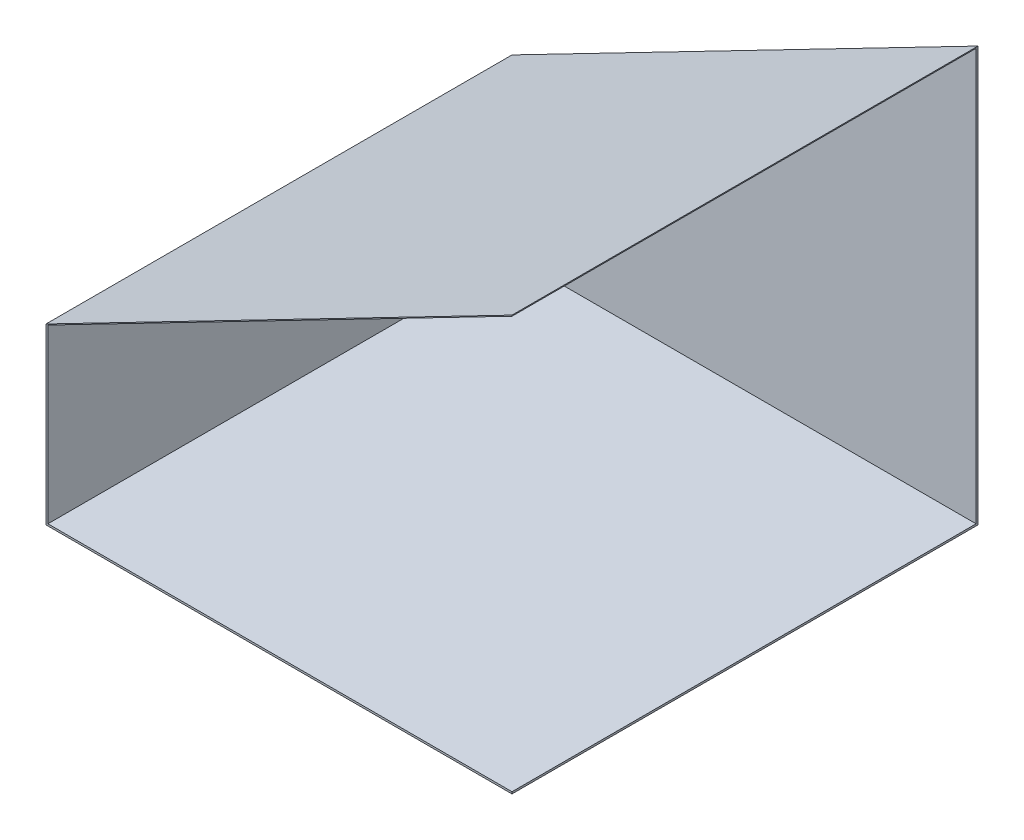
from build123d import *

# Parameters (mm, degrees)
SKETCH2_W           = 12192
SKETCH2_H           = 12192
BOSS_EXTRUDE1_DEPTH = 50.8
SKETCH3_W           = 12192
SKETCH3_H           = 4572
BOSS_EXTRUDE2_DEPTH = 50.8
SKETCH4_W           = 12242.8
SKETCH4_H           = 4572
BOSS_EXTRUDE3_DEPTH = 50.8
BOSS_EXTRUDE4_REACH = 17874.722
BOSS_EXTRUDE5_DEPTH = 50.8


with BuildPart() as part:
    # Sketch2 → Boss-Extrude1 (new body)
    with BuildSketch(Plane(origin=(0, 0, 0), x_dir=(1, 0, 0), z_dir=(0, 1, 0))):
        with Locations((6096, 6096)):
            Rectangle(SKETCH2_W, SKETCH2_H)
    extrude(amount=BOSS_EXTRUDE1_DEPTH)

    # Sketch3 → Boss-Extrude2 (add)
    with BuildSketch(Plane.ZY):
        with Locations((-6096, 2286)):
            Rectangle(SKETCH3_W, SKETCH3_H)
    extrude(amount=BOSS_EXTRUDE2_DEPTH)

    # Sketch4 → Boss-Extrude3 (add)
    with BuildSketch(Plane(origin=(0, 0, -12192), x_dir=(-1, 0, 0), z_dir=(0, 0, -1))):
        with Locations((-6070.6, 2286)):
            Rectangle(SKETCH4_W, SKETCH4_H)
    extrude(amount=BOSS_EXTRUDE3_DEPTH)

    # Boss-Extrude4: up to this face of the body (flat: up to its plane)
    boss_extrude4_end = Plane(part.part.faces().sort_by_distance((6070.6, 2286, -12242.8))[0])
    # Sketch5 → Boss-Extrude4 (add, up to the picked face)
    with BuildSketch(Plane.XY, mode=Mode.PRIVATE) as boss_extrude4_sk1:
        Polygon((-50.8, 4572), (0, 4572), (12192, 10868.829376601), (12192, 10895.06616567), align=None)
    boss_extrude4_tool1 = split(extrude(boss_extrude4_sk1.sketch, amount=-BOSS_EXTRUDE4_REACH, mode=Mode.PRIVATE), bisect_by=boss_extrude4_end, keep=Keep.BOTH, mode=Mode.PRIVATE)
    add(boss_extrude4_tool1.solids().sort_by(Axis((6083.291199, 7726.978431, 0), (0, 0, -1)))[0])

    # Sketch6 → Boss-Extrude5 (add)
    with BuildSketch(Plane(origin=(0, 0, -12242.8), x_dir=(-1, 0, 0), z_dir=(0, 0, -1))):
        Polygon((-12192, 10895.06616567), (-12192, 4572), (50.8, 4572), align=None)
    extrude(amount=-BOSS_EXTRUDE5_DEPTH)


solid = part.part
